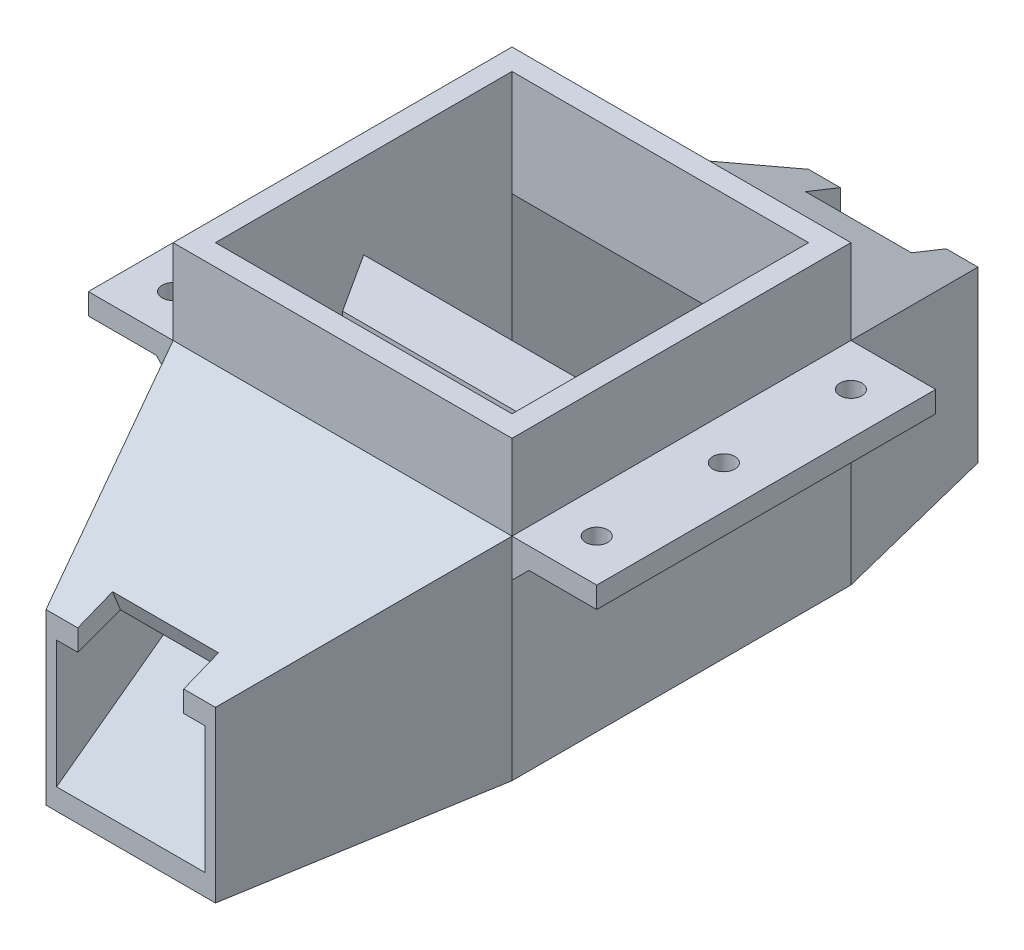
from build123d import *

# Parameters (mm, degrees)
EXTRUDE_1_DEPTH     = 80
SKETCH_4_R          = 2.6
CUT_EXTRUDE_2_DEPTH = 150
CHAMFER_1_SIZE      = 4
CHAMFER_2_SIZE      = 4
SKETCH_8_W          = 70
SKETCH_8_H          = 70
CUT_EXTRUDE_3_DEPTH = 70
EXTRUDE_3_DEPTH     = 80
EXTRUDE_4_DEPTH     = 80
SKETCH_25_W         = 25
SKETCH_25_H         = 25.122105301
CUT_EXTRUDE_8_DEPTH = 20


with BuildPart() as part:
    # 草图2 → 凸台-拉伸1 (new body)
    with BuildSketch(Plane.XY):
        Polygon((0, 0), (0, -45), (80, -45), (80, 0), (100, 0), (100, 5), (80, 5), (80, 25), (0, 25), (0, 5), (-20, 5), (-20, 0), align=None)
    extrude(amount=EXTRUDE_1_DEPTH)

    # 草图4 → 切除-拉伸2 (cut)
    with BuildSketch(Plane(origin=(0, 5, 0), x_dir=(1, 0, 0), z_dir=(0, 1, 0))):
        with Locations(Location((-10, -40, 0), (0, 0, 180))):
            Circle(SKETCH_4_R)
        with Locations(Location((-10, -70, 0), (0, 0, 180))):
            Circle(SKETCH_4_R)
        with Locations(Location((-10, -10, 0), (0, 0, 180))):
            Circle(SKETCH_4_R)
        with Locations(Location((90, -10, 0), (0, 0, 180))):
            Circle(SKETCH_4_R)
        with Locations(Location((90, -40, 0), (0, 0, 180))):
            Circle(SKETCH_4_R)
        with Locations(Location((90, -70, 0), (0, 0, 180))):
            Circle(SKETCH_4_R)
    extrude(amount=-CUT_EXTRUDE_2_DEPTH, mode=Mode.SUBTRACT)

    # 倒角1
    chamfer_1_edges = [part.edges().sort_by_distance(p)[0] for p in [
        (80, 0, 40),
    ]]
    chamfer(chamfer_1_edges, length=CHAMFER_1_SIZE)

    # 倒角2
    chamfer_2_edges = [part.edges().sort_by_distance(p)[0] for p in [
        (0, 0, 40),
    ]]
    chamfer(chamfer_2_edges, length=CHAMFER_2_SIZE)

    # 草图8 → 切除-拉伸3 (cut)
    with BuildSketch(Plane(origin=(0, 25, 0), x_dir=(1, 0, 0), z_dir=(0, 1, 0))):
        with Locations((40, -40)):
            Rectangle(SKETCH_8_W, SKETCH_8_H)
    extrude(amount=-CUT_EXTRUDE_3_DEPTH, mode=Mode.SUBTRACT)

    # 草图19 → 放样3 section 0
    with BuildSketch(Plane(origin=(0, 0, -50), x_dir=(-1, 0, 0), z_dir=(0, 0, -1))):
        with BuildLine():
            Line((-60, -15), (-20, -15))
            Line((-20, -15), (-20, -55))
            Line((-20, -55), (-60, -55))
            Line((-60, -55), (-60, -15))
        make_face()
    # 草图17 → 放样3 section 1
    with BuildSketch(Plane(origin=(0, 0, 0), x_dir=(-1, 0, 0), z_dir=(0, 0, -1))):
        with BuildLine():
            Line((-80, 5), (0, 5))
            Line((0, 5), (0, -45))
            Line((0, -45), (-80, -45))
            Line((-80, -45), (-80, 5))
        make_face()
    loft_3 = loft()

    # 草图22 → 凸台-拉伸3 (add)
    with BuildSketch(Plane(origin=(80, 0, 0), x_dir=(0, 0, -1), z_dir=(1, 0, 0))):
        Polygon((-80, -45), (0, -45), (0, -40), (-40, -32), (-80, -40), align=None)
    extrude(amount=-EXTRUDE_3_DEPTH)

    # 草图20 → 切除-放样6 section 0
    with BuildSketch(Plane.XY.offset(5)):
        with BuildLine():
            Line((5, 0), (75, 0))
            Line((75, 0), (75, -40))
            Line((75, -40), (5, -40))
            Line((5, -40), (5, 0))
        make_face()
    # 草图21 → 切除-放样6 section 1
    with BuildSketch(Plane(origin=(0, 0, -50), x_dir=(-1, 0, 0), z_dir=(0, 0, -1))):
        with BuildLine():
            Line((-57.5, -20), (-22.5, -20))
            Line((-22.5, -20), (-22.5, -50))
            Line((-22.5, -50), (-57.5, -50))
            Line((-57.5, -50), (-57.5, -20))
        make_face()
    loft_6 = loft(mode=Mode.SUBTRACT)

    # 镜向1: 放样3, 切除-放样6 across plane
    add(loft_3.mirror(Plane.XY.offset(40)))
    add(loft_6.mirror(Plane.XY.offset(40)), mode=Mode.SUBTRACT)

    # 草图23 → 凸台-拉伸4 (add)
    with BuildSketch(Plane(origin=(80, 0, 0), x_dir=(0, 0, -1), z_dir=(1, 0, 0))):
        Polygon((-45, -45), (-45, -4), (-40, 5), (-35, -4), (-35, -45), align=None)
    extrude(amount=-EXTRUDE_4_DEPTH)

    # 草图25 → 切除-拉伸8 (cut)
    with BuildSketch(Plane(origin=(0, 31.896551724, 12.75862069), x_dir=(1, 0, 0), z_dir=(0, 0.9284766908852594, 0.3713906763541038))):
        with Locations((40, -129.98223454)):
            Rectangle(SKETCH_25_W, SKETCH_25_H)
    cut_extrude_8 = extrude(amount=-CUT_EXTRUDE_8_DEPTH, mode=Mode.SUBTRACT)

    # 镜向2: 切除-拉伸8 across plane
    add(cut_extrude_8.mirror(Plane.XY.offset(40)), mode=Mode.SUBTRACT)


solid = part.part
